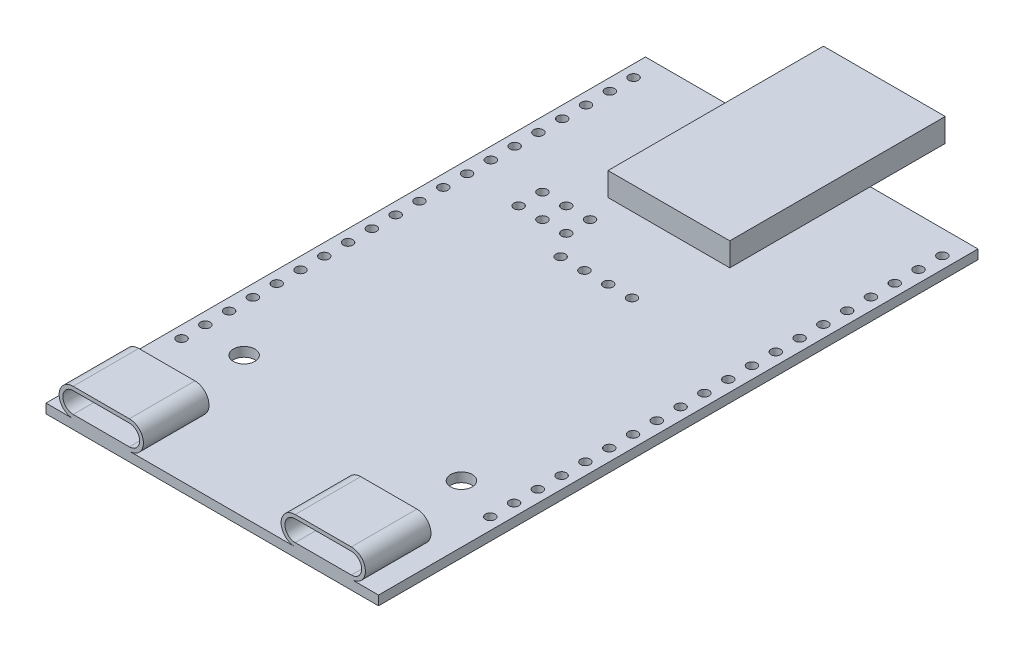
from build123d import *

# Parameters (mm, degrees)
SCHIZZO1_W                   = 35.5
SCHIZZO1_H                   = 64
ESTRUSIONE_ESTRUSIONE1_DEPTH = 1
SCHIZZO2_W                   = 13
SCHIZZO2_H                   = 23
ESTRUSIONE_ESTRUSIONE2_DEPTH = 2.5
SCHIZZO3_R                   = 0.51
TAGLIO_ESTRUSIONE1_DEPTH     = 2.5
ESTRUSIONE_ESTRUSIONE3_DEPTH = 7
TAGLIO_ESTRUSIONE2_DEPTH     = 6
SCHIZZO7_R                   = 1.15
TAGLIO_ESTRUSIONE3_DEPTH     = 6


with BuildPart() as part:
    # Schizzo1 → Estrusione-Estrusione1 (new body)
    with BuildSketch(Plane(origin=(0, 0, 0), x_dir=(1, 0, 0), z_dir=(0, 1, 0))):
        with Locations((-17.75, 32)):
            Rectangle(SCHIZZO1_W, SCHIZZO1_H)
    extrude(amount=ESTRUSIONE_ESTRUSIONE1_DEPTH)

    # Schizzo2 → Estrusione-Estrusione2 (add)
    with BuildSketch(Plane(origin=(0, 1, 0), x_dir=(1, 0, 0), z_dir=(0, 1, 0))):
        with Locations((-18, 60.5)):
            Rectangle(SCHIZZO2_W, SCHIZZO2_H)
    extrude(amount=ESTRUSIONE_ESTRUSIONE2_DEPTH)

    # Schizzo3 → Taglio-Estrusione1 (cut)
    with BuildSketch(Plane(origin=(0, 1, 0), x_dir=(1, 0, 0), z_dir=(0, 1, 0))):
        with Locations((-1.27, 61.46)):
            Circle(SCHIZZO3_R)
        with Locations((-1.27, 58.92)):
            Circle(SCHIZZO3_R)
        with Locations((-1.27, 56.38)):
            Circle(SCHIZZO3_R)
        with Locations((-1.27, 53.84)):
            Circle(SCHIZZO3_R)
        with Locations((-1.27, 51.3)):
            Circle(SCHIZZO3_R)
        with Locations((-1.27, 48.76)):
            Circle(SCHIZZO3_R)
        with Locations((-1.27, 46.22)):
            Circle(SCHIZZO3_R)
        with Locations((-1.27, 43.68)):
            Circle(SCHIZZO3_R)
        with Locations((-1.27, 41.14)):
            Circle(SCHIZZO3_R)
        with Locations((-1.27, 38.6)):
            Circle(SCHIZZO3_R)
        with Locations((-1.27, 36.06)):
            Circle(SCHIZZO3_R)
        with Locations((-1.27, 33.52)):
            Circle(SCHIZZO3_R)
        with Locations((-1.27, 30.98)):
            Circle(SCHIZZO3_R)
        with Locations((-1.27, 28.44)):
            Circle(SCHIZZO3_R)
        with Locations((-1.27, 25.9)):
            Circle(SCHIZZO3_R)
        with Locations((-1.27, 23.36)):
            Circle(SCHIZZO3_R)
        with Locations((-1.27, 20.82)):
            Circle(SCHIZZO3_R)
        with Locations((-1.27, 18.28)):
            Circle(SCHIZZO3_R)
        with Locations((-1.27, 15.74)):
            Circle(SCHIZZO3_R)
        with Locations((-1.27, 13.2)):
            Circle(SCHIZZO3_R)
        with Locations((-34.23, 61.46)):
            Circle(SCHIZZO3_R)
        with Locations((-34.23, 58.92)):
            Circle(SCHIZZO3_R)
        with Locations((-34.23, 56.38)):
            Circle(SCHIZZO3_R)
        with Locations((-34.23, 53.84)):
            Circle(SCHIZZO3_R)
        with Locations((-34.23, 51.3)):
            Circle(SCHIZZO3_R)
        with Locations((-34.23, 48.76)):
            Circle(SCHIZZO3_R)
        with Locations((-34.23, 46.22)):
            Circle(SCHIZZO3_R)
        with Locations((-34.23, 43.68)):
            Circle(SCHIZZO3_R)
        with Locations((-34.23, 41.14)):
            Circle(SCHIZZO3_R)
        with Locations((-34.23, 38.6)):
            Circle(SCHIZZO3_R)
        with Locations((-34.23, 36.06)):
            Circle(SCHIZZO3_R)
        with Locations((-34.23, 33.52)):
            Circle(SCHIZZO3_R)
        with Locations((-34.23, 30.98)):
            Circle(SCHIZZO3_R)
        with Locations((-34.23, 28.44)):
            Circle(SCHIZZO3_R)
        with Locations((-34.23, 25.9)):
            Circle(SCHIZZO3_R)
        with Locations((-34.23, 23.36)):
            Circle(SCHIZZO3_R)
        with Locations((-34.23, 20.82)):
            Circle(SCHIZZO3_R)
        with Locations((-34.23, 18.28)):
            Circle(SCHIZZO3_R)
        with Locations((-34.23, 15.74)):
            Circle(SCHIZZO3_R)
        with Locations((-34.23, 13.2)):
            Circle(SCHIZZO3_R)
        with Locations((-21.56, 41)):
            Circle(SCHIZZO3_R)
        with Locations((-19.02, 41)):
            Circle(SCHIZZO3_R)
        with Locations((-16.48, 41)):
            Circle(SCHIZZO3_R)
        with Locations((-13.94, 41)):
            Circle(SCHIZZO3_R)
        with Locations((-28.5, 46)):
            Circle(SCHIZZO3_R)
        with Locations((-25.96, 46)):
            Circle(SCHIZZO3_R)
        with Locations((-23.42, 46)):
            Circle(SCHIZZO3_R)
        with Locations((-28.5, 43.46)):
            Circle(SCHIZZO3_R)
        with Locations((-25.96, 43.46)):
            Circle(SCHIZZO3_R)
        with Locations((-23.42, 43.46)):
            Circle(SCHIZZO3_R)
    extrude(amount=-TAGLIO_ESTRUSIONE1_DEPTH, mode=Mode.SUBTRACT)

    # Schizzo6 → Estrusione-Estrusione3 (add)
    with BuildSketch(Plane.XY):
        with BuildLine():
            ThreePointArc((-8.9, 4), (-10.4, 2.5), (-8.9, 1))
            Line((-8.9, 1), (-2.9, 1))
            ThreePointArc((-2.9, 1), (-1.4, 2.5), (-2.9, 4))
            Line((-2.9, 4), (-8.9, 4))
        make_face()
        with BuildLine():
            Line((-26.6, 4), (-32.6, 4))
            ThreePointArc((-32.6, 4), (-34.1, 2.5), (-32.6, 1))
            Line((-32.6, 1), (-26.6, 1))
            ThreePointArc((-26.6, 1), (-25.1, 2.5), (-26.6, 4))
        make_face()
    extrude(amount=-ESTRUSIONE_ESTRUSIONE3_DEPTH)

    # Schizzo6<3> → Taglio-Estrusione2 (cut)
    with BuildSketch(Plane.XY):
        with BuildLine():
            Line((-26.6, 3.6), (-32.6, 3.6))
            ThreePointArc((-32.6, 3.6), (-33.7, 2.5), (-32.6, 1.4))
            Line((-32.6, 1.4), (-26.6, 1.4))
            ThreePointArc((-26.6, 1.4), (-25.5, 2.5), (-26.6, 3.6))
        make_face()
        with BuildLine():
            Line((-2.9, 3.6), (-8.9, 3.6))
            ThreePointArc((-8.9, 3.6), (-10, 2.5), (-8.9, 1.4))
            Line((-8.9, 1.4), (-2.9, 1.4))
            ThreePointArc((-2.9, 1.4), (-1.8, 2.5), (-2.9, 3.6))
        make_face()
    extrude(amount=-TAGLIO_ESTRUSIONE2_DEPTH, mode=Mode.SUBTRACT)

    # Schizzo7 → Taglio-Estrusione3 (cut)
    with BuildSketch(Plane(origin=(0, 1, 0), x_dir=(1, 0, 0), z_dir=(0, 1, 0))):
        with Locations((-29.35, 15)):
            Circle(SCHIZZO7_R)
        with Locations((-6.15, 15)):
            Circle(SCHIZZO7_R)
    extrude(amount=-TAGLIO_ESTRUSIONE3_DEPTH, mode=Mode.SUBTRACT)


solid = part.part
